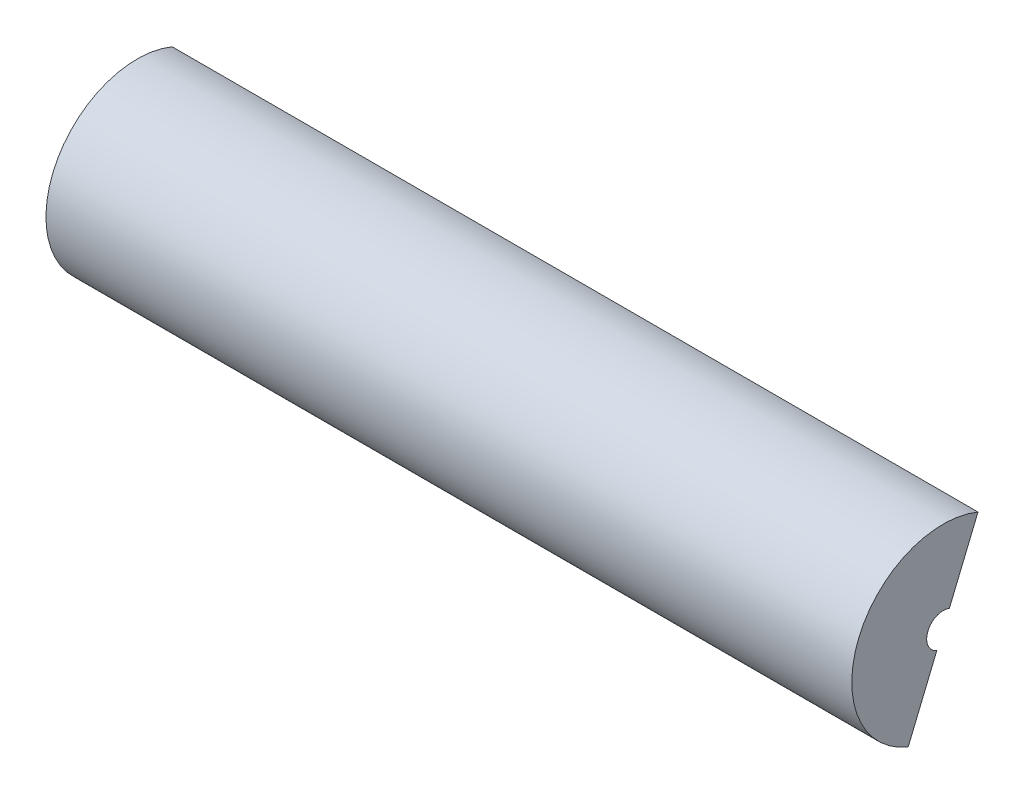
from build123d import *

# Parameters (mm, degrees)
CUT_EXTRUDE1_REACH = 247.25
SKETCH3_R          = 0.80645
SKETCH4_W          = 62
SKETCH4_H          = 273.6661
CUT_EXTRUDE2_DEPTH = 278.155433447


with BuildPart() as part:
    # Sketch1 → Revolve1 (revolve)
    with BuildSketch(Plane.XY, mode=Mode.PRIVATE) as revolve1_sk:
        Polygon((0, 12.7), (196.85, 12.7), (196.85, 26.162), (241.3, 26.162), (241.3, 0), (259.36, 0), (259.36, 10.7696), (273.6661, 5.5626), (273.6661, 31), (0, 31), align=None)
    revolve(revolve1_sk.sketch.rotate(Axis((0, 0, 0), (1, 0, 0)), 90), axis=Axis((0, 0, 0), (1, 0, 0)))

    # Sketch3 → Cut-Extrude1 (cut, up to next)
    with BuildSketch(Plane.ZY.offset(-241.3), mode=Mode.PRIVATE) as cut_extrude1_sk1:
        with Locations((0, 6.477)):
            Circle(SKETCH3_R)
    cut_extrude1_tool1 = extrude(cut_extrude1_sk1.sketch, amount=-CUT_EXTRUDE1_REACH, mode=Mode.PRIVATE) & part.part
    # Sketch3 → Cut-Extrude1 (cut, up to next)
    with BuildSketch(Plane.ZY.offset(-241.3), mode=Mode.PRIVATE) as cut_extrude1_sk2:
        with Locations((4.579930622, 4.579930622)):
            Circle(SKETCH3_R)
    cut_extrude1_tool2 = extrude(cut_extrude1_sk2.sketch, amount=-CUT_EXTRUDE1_REACH, mode=Mode.PRIVATE) & part.part
    # Sketch3 → Cut-Extrude1 (cut, up to next)
    with BuildSketch(Plane.ZY.offset(-241.3), mode=Mode.PRIVATE) as cut_extrude1_sk3:
        with Locations((6.477, 0)):
            Circle(SKETCH3_R)
    cut_extrude1_tool3 = extrude(cut_extrude1_sk3.sketch, amount=-CUT_EXTRUDE1_REACH, mode=Mode.PRIVATE) & part.part
    # Sketch3 → Cut-Extrude1 (cut, up to next)
    with BuildSketch(Plane.ZY.offset(-241.3), mode=Mode.PRIVATE) as cut_extrude1_sk4:
        with Locations((4.579930622, -4.579930622)):
            Circle(SKETCH3_R)
    cut_extrude1_tool4 = extrude(cut_extrude1_sk4.sketch, amount=-CUT_EXTRUDE1_REACH, mode=Mode.PRIVATE) & part.part
    # Sketch3 → Cut-Extrude1 (cut, up to next)
    with BuildSketch(Plane.ZY.offset(-241.3), mode=Mode.PRIVATE) as cut_extrude1_sk5:
        with Locations((0, -6.477)):
            Circle(SKETCH3_R)
    cut_extrude1_tool5 = extrude(cut_extrude1_sk5.sketch, amount=-CUT_EXTRUDE1_REACH, mode=Mode.PRIVATE) & part.part
    # Sketch3 → Cut-Extrude1 (cut, up to next)
    with BuildSketch(Plane.ZY.offset(-241.3), mode=Mode.PRIVATE) as cut_extrude1_sk6:
        with Locations((-4.579930622, -4.579930622)):
            Circle(SKETCH3_R)
    cut_extrude1_tool6 = extrude(cut_extrude1_sk6.sketch, amount=-CUT_EXTRUDE1_REACH, mode=Mode.PRIVATE) & part.part
    # Sketch3 → Cut-Extrude1 (cut, up to next)
    with BuildSketch(Plane.ZY.offset(-241.3), mode=Mode.PRIVATE) as cut_extrude1_sk7:
        with Locations((-6.477, 0)):
            Circle(SKETCH3_R)
    cut_extrude1_tool7 = extrude(cut_extrude1_sk7.sketch, amount=-CUT_EXTRUDE1_REACH, mode=Mode.PRIVATE) & part.part
    # Sketch3 → Cut-Extrude1 (cut, up to next)
    with BuildSketch(Plane.ZY.offset(-241.3), mode=Mode.PRIVATE) as cut_extrude1_sk8:
        with Locations((-4.579930622, 4.579930622)):
            Circle(SKETCH3_R)
    cut_extrude1_tool8 = extrude(cut_extrude1_sk8.sketch, amount=-CUT_EXTRUDE1_REACH, mode=Mode.PRIVATE) & part.part
    add(cut_extrude1_tool1.solids().sort_by_distance((241.3, 6.477, 0))[0], mode=Mode.SUBTRACT)
    add(cut_extrude1_tool2.solids().sort_by_distance((241.3, 4.579931, 4.579931))[0], mode=Mode.SUBTRACT)
    add(cut_extrude1_tool3.solids().sort_by_distance((241.3, 0, 6.477))[0], mode=Mode.SUBTRACT)
    add(cut_extrude1_tool4.solids().sort_by_distance((241.3, -4.579931, 4.579931))[0], mode=Mode.SUBTRACT)
    add(cut_extrude1_tool5.solids().sort_by_distance((241.3, -6.477, 0))[0], mode=Mode.SUBTRACT)
    add(cut_extrude1_tool6.solids().sort_by_distance((241.3, -4.579931, -4.579931))[0], mode=Mode.SUBTRACT)
    add(cut_extrude1_tool7.solids().sort_by_distance((241.3, 0, -6.477))[0], mode=Mode.SUBTRACT)
    add(cut_extrude1_tool8.solids().sort_by_distance((241.3, 4.579931, -4.579931))[0], mode=Mode.SUBTRACT)

    # Sketch4 → Cut-Extrude2 (cut, through all)
    with BuildSketch(Plane(origin=(0, 0, 0), x_dir=(0, -0.9238795325112865, 0.38268343236509056), z_dir=(0, 0.3826834323650905, 0.9238795325112864))):
        with Locations((0, 136.83305)):
            Rectangle(SKETCH4_W, SKETCH4_H)
    extrude(amount=-CUT_EXTRUDE2_DEPTH, mode=Mode.SUBTRACT)


solid = part.part
